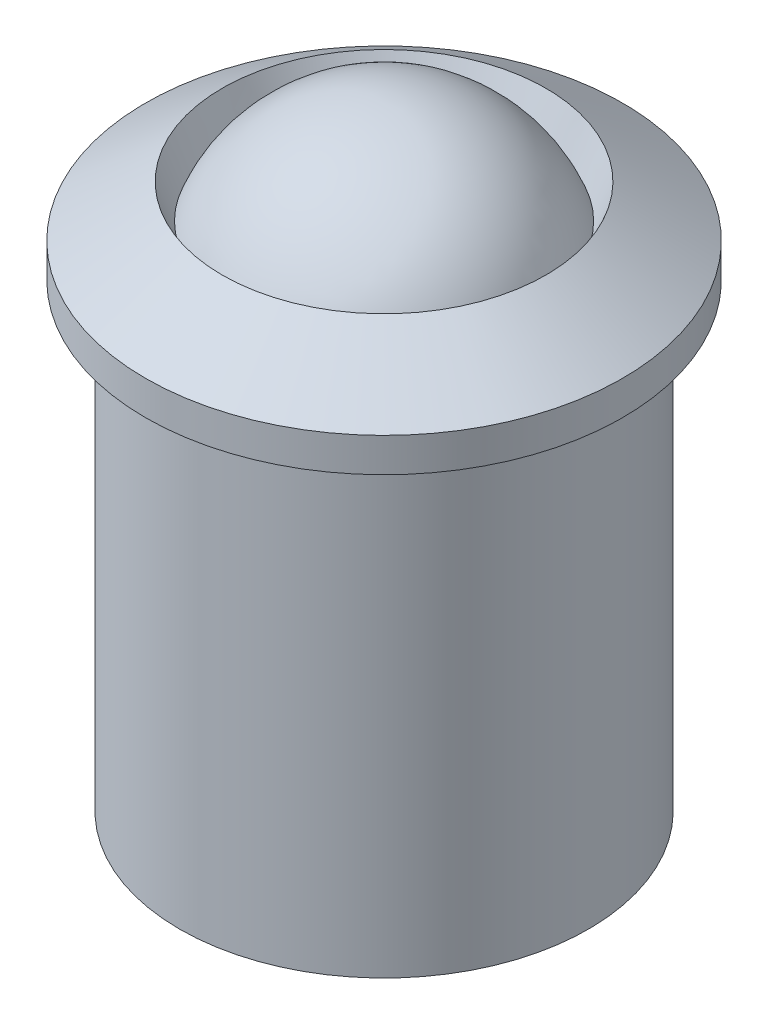
from build123d import *

# Parameters (mm, degrees)
DOME2_FACE_RADIUS  = 4.35
DOME2_HEIGHT       = 3
SKETCH6_R          = 5
CUT_EXTRUDE1_DEPTH = 7.5


with BuildPart() as part:
    # Sketch1 → Revolve1 (revolve)
    with BuildSketch(Plane(origin=(0, 0, 0), x_dir=(0, 0, -1), z_dir=(1, 0, 0))):
        Polygon((0, 0), (-6, 0), (-6, 13.5), (-7, 13.5), (-7, 14.5), (-4.75, 16), (-4.35, 15), (0, 15), align=None)
    revolve(axis=Axis((0, 15, 0), (0, -1, 0)))

    # Dome2: a dome of height H over a round flat face of radius A is a cap of a sphere of radius (A * A + H * H) / (2 * H)
    dome2_r = (DOME2_FACE_RADIUS * DOME2_FACE_RADIUS + DOME2_HEIGHT * DOME2_HEIGHT) / (2 * DOME2_HEIGHT)
    dome2_base = Plane((0, 15, 0), z_dir=(0, 1, 0))
    with Locations(dome2_base.offset(DOME2_HEIGHT - dome2_r)):
        dome2_ball = Sphere(dome2_r, mode=Mode.PRIVATE)
    add(split(dome2_ball, bisect_by=dome2_base, keep=Keep.TOP, mode=Mode.PRIVATE))

    # Sketch6 → Cut-Extrude1 (cut)
    with BuildSketch(Plane.XZ):
        with Locations(Location((0, 0, 0), (0, 0, 270))):
            Circle(SKETCH6_R)
    extrude(amount=-CUT_EXTRUDE1_DEPTH, mode=Mode.SUBTRACT)


solid = part.part
